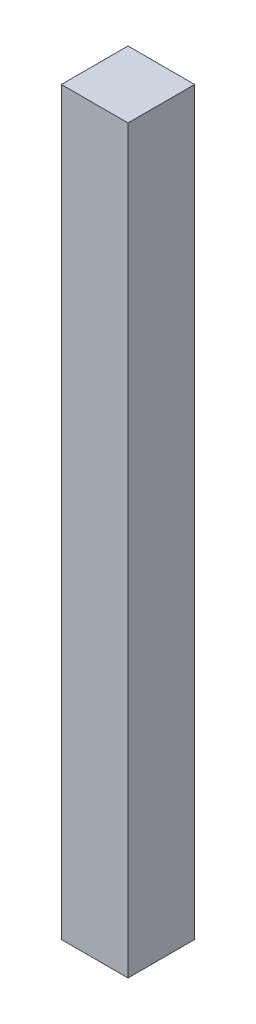
from build123d import *

# Parameters (mm, degrees)
TOPPING_KLAPE_ALT1_GAZLI_AMORTISOR_2_1_START = 8
SKETCH1_W                                    = 18
SKETCH1_H                                    = 200
TOPPING_KLAPE_ALT1_GAZLI_AMORTISOR_2_1_DEPTH = 18


with BuildPart() as part:
    # Sketch1 → TOPPING_klape_alt1_gazli_amortisor_2_1 (new body)
    with BuildSketch(Plane.XY.offset(TOPPING_KLAPE_ALT1_GAZLI_AMORTISOR_2_1_START)):
        with Locations((646, 590)):
            Rectangle(SKETCH1_W, SKETCH1_H)
    extrude(amount=TOPPING_KLAPE_ALT1_GAZLI_AMORTISOR_2_1_DEPTH)


solid = part.part
